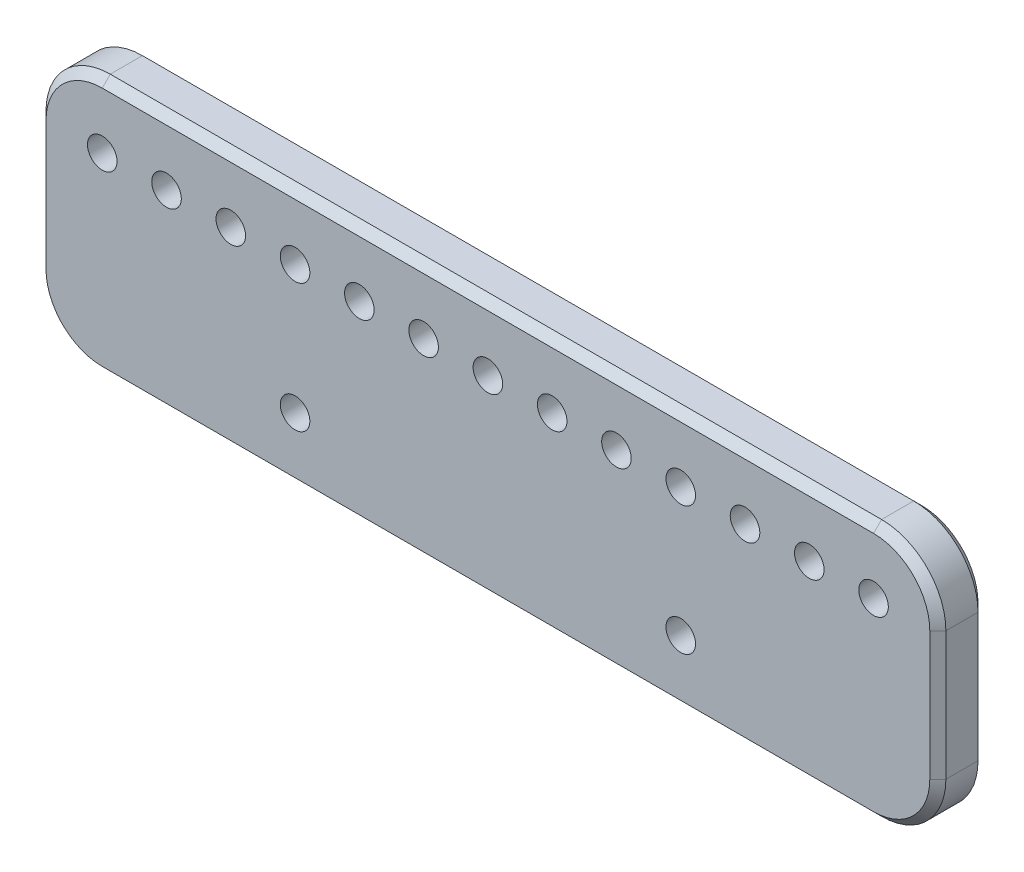
from build123d import *

# Parameters (mm, degrees)
SKETCH1_W           = 177.8
SKETCH1_H           = 50.8
SKETCH1_R           = 2.921
BOSS_EXTRUDE1_DEPTH = 9.525
FILLET1_R           = 12.7
CHAMFER1_SIZE       = 1.5875


with BuildPart() as part:
    # Sketch1 → Boss-Extrude1 (new body)
    with BuildSketch(Plane.XY):
        with Locations((88.9, 25.4)):
            Rectangle(SKETCH1_W, SKETCH1_H)
        with Locations(Location((50.8, 12.7, 0), (0, 0, 180))):
            Circle(SKETCH1_R, mode=Mode.SUBTRACT)
        with Locations(Location((127, 12.7, 0), (0, 0, 180))):
            Circle(SKETCH1_R, mode=Mode.SUBTRACT)
        with Locations(Location((12.7, 38.1, 0), (0, 0, 180))):
            Circle(SKETCH1_R, mode=Mode.SUBTRACT)
        with Locations(Location((25.4, 38.1, 0), (0, 0, 180))):
            Circle(SKETCH1_R, mode=Mode.SUBTRACT)
        with Locations(Location((38.1, 38.1, 0), (0, 0, 180))):
            Circle(SKETCH1_R, mode=Mode.SUBTRACT)
        with Locations(Location((50.8, 38.1, 0), (0, 0, 180))):
            Circle(SKETCH1_R, mode=Mode.SUBTRACT)
        with Locations(Location((63.5, 38.1, 0), (0, 0, 180))):
            Circle(SKETCH1_R, mode=Mode.SUBTRACT)
        with Locations(Location((76.2, 38.1, 0), (0, 0, 180))):
            Circle(SKETCH1_R, mode=Mode.SUBTRACT)
        with Locations(Location((88.9, 38.1, 0), (0, 0, 180))):
            Circle(SKETCH1_R, mode=Mode.SUBTRACT)
        with Locations(Location((101.6, 38.1, 0), (0, 0, 180))):
            Circle(SKETCH1_R, mode=Mode.SUBTRACT)
        with Locations(Location((114.3, 38.1, 0), (0, 0, 180))):
            Circle(SKETCH1_R, mode=Mode.SUBTRACT)
        with Locations(Location((127, 38.1, 0), (0, 0, 180))):
            Circle(SKETCH1_R, mode=Mode.SUBTRACT)
        with Locations(Location((139.7, 38.1, 0), (0, 0, 180))):
            Circle(SKETCH1_R, mode=Mode.SUBTRACT)
        with Locations(Location((152.4, 38.1, 0), (0, 0, 180))):
            Circle(SKETCH1_R, mode=Mode.SUBTRACT)
        with Locations(Location((165.1, 38.1, 0), (0, 0, 180))):
            Circle(SKETCH1_R, mode=Mode.SUBTRACT)
    extrude(amount=BOSS_EXTRUDE1_DEPTH)

    # Fillet1
    fillet1_edges = [part.edges().sort_by_distance(p)[0] for p in [
        (0, 50.8, 4.7625),
        (177.8, 50.8, 4.7625),
        (177.8, 0, 4.7625),
        (0, 0, 4.7625),
    ]]
    fillet(fillet1_edges, radius=FILLET1_R)

    # Chamfer1
    chamfer1_edges = [part.edges().sort_by_distance(p)[0] for p in [
        (88.9, 0, 0),
        (88.9, 0, 9.525),
        (0, 25.4, 0),
        (88.9, 50.8, 0),
        (177.8, 25.4, 0),
        (174.080256121, 47.080256121, 0),
        (174.080256121, 3.719743879, 0),
        (3.719743879, 47.080256121, 0),
        (3.719743879, 3.719743879, 0),
        (0, 25.4, 9.525),
        (177.8, 25.4, 9.525),
        (88.9, 50.8, 9.525),
        (174.080256121, 47.080256121, 9.525),
        (174.080256121, 3.719743879, 9.525),
        (3.719743879, 47.080256121, 9.525),
        (3.719743879, 3.719743879, 9.525),
    ]]
    chamfer(chamfer1_edges, length=CHAMFER1_SIZE)


solid = part.part
